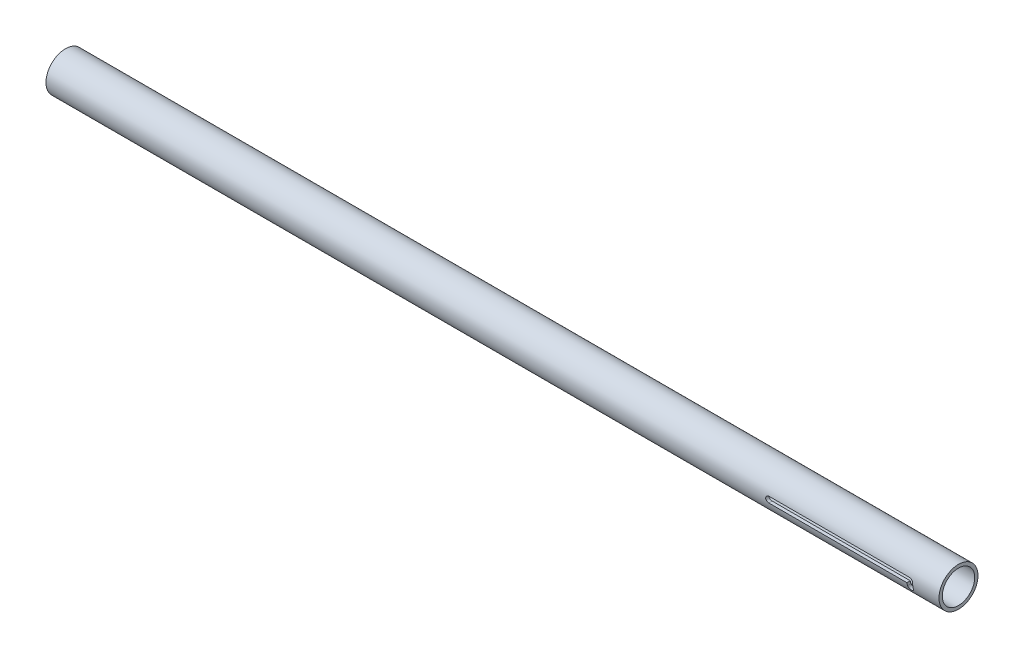
from build123d import *

# Parameters (mm, degrees)
SKETCH1_R           = 21.082
SKETCH1_R_2         = 17.526
BOSS_EXTRUDE1_DEPTH = 965.2
CUT_EXTRUDE1_DEPTH  = 966.660365474
CUT_EXTRUDE2_DEPTH  = 966.660365579


with BuildPart() as part:
    # Sketch1 → Boss-Extrude1 (new body)
    with BuildSketch(Plane(origin=(0, 0, 0), x_dir=(0, 0, -1), z_dir=(1, 0, 0))):
        with Locations(Location((0, 0, 0), (0, 0, 180))):
            Circle(SKETCH1_R)
        with Locations(Location((0, 0, 0), (0, 0, 180))):
            Circle(SKETCH1_R_2, mode=Mode.SUBTRACT)
    extrude(amount=BOSS_EXTRUDE1_DEPTH)

    # Sketch2 → Cut-Extrude1 (cut, through all)
    with BuildSketch(Plane.XY):
        with BuildLine():
            Line((7.9375, 3.175), (20.6375, 3.175))
            ThreePointArc((20.6375, 3.175), (23.8125, 0), (20.6375, -3.175))
            Line((20.6375, -3.175), (7.9375, -3.175))
            ThreePointArc((7.9375, -3.175), (4.7625, 0), (7.9375, 3.175))
        make_face()
        with BuildLine():
            Line((46.0375, 3.175), (58.7375, 3.175))
            ThreePointArc((58.7375, 3.175), (61.9125, 0), (58.7375, -3.175))
            Line((58.7375, -3.175), (46.0375, -3.175))
            ThreePointArc((46.0375, -3.175), (42.8625, 0), (46.0375, 3.175))
        make_face()
    extrude(amount=-CUT_EXTRUDE1_DEPTH, mode=Mode.SUBTRACT)

    # Sketch3 → Cut-Extrude2 (cut, through all)
    with BuildSketch(Plane.XY):
        with BuildLine():
            Line((781.05, 3.175), (933.45, 3.175))
            ThreePointArc((933.45, 3.175), (935.69506403, 2.24506403), (936.625, 0))
            Line((936.625, 0), (936.625, -6.35))
            ThreePointArc((936.625, -6.35), (933.45, -9.525), (930.275, -6.35))
            Line((930.275, -6.35), (930.275, -3.175))
            Line((930.275, -3.175), (781.05, -3.175))
            ThreePointArc((781.05, -3.175), (777.875, 0), (781.05, 3.175))
        make_face()
    extrude(amount=CUT_EXTRUDE2_DEPTH, mode=Mode.SUBTRACT)


solid = part.part
